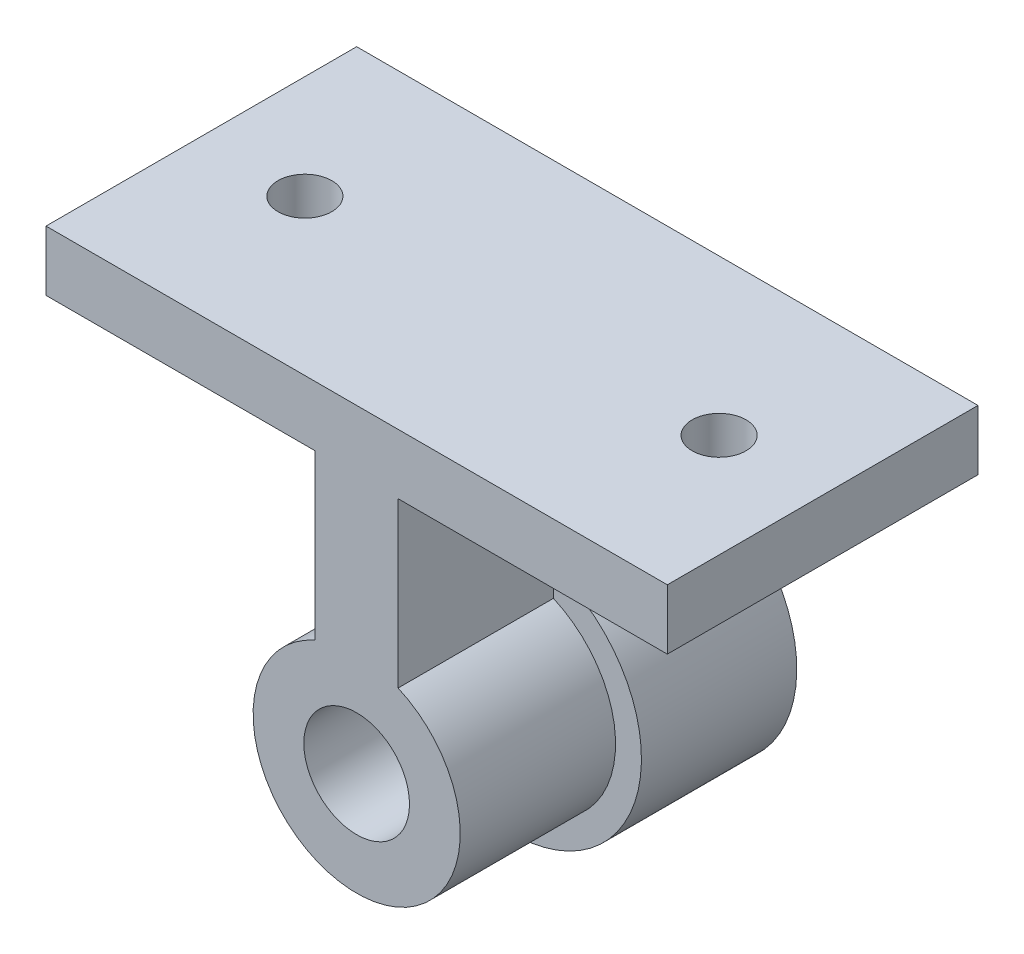
from build123d import *

# Parameters (mm, degrees)
SKETCH1_W           = 60
SKETCH1_H           = 30
BOSS_EXTRUDE1_DEPTH = 5.8
SKETCH2_R           = 2.6
CUT_EXTRUDE1_DEPTH  = 6
SKETCH3_R           = 5.1
BOSS_EXTRUDE2_DEPTH = 15
BOSS_EXTRUDE3_START = -15
SKETCH4_R           = 5.1
BOSS_EXTRUDE3_DEPTH = 15
SKETCH5_R           = 10.75
CUT_EXTRUDE2_DEPTH  = 11


with BuildPart() as part:
    # Sketch1 → Boss-Extrude1 (new body)
    with BuildSketch(Plane(origin=(0, 0, 0), x_dir=(1, 0, 0), z_dir=(0, 1, 0))):
        Rectangle(SKETCH1_W, SKETCH1_H)
    extrude(amount=BOSS_EXTRUDE1_DEPTH)

    # Sketch2 → Cut-Extrude1 (cut)
    with BuildSketch(Plane(origin=(0, 0, 0), x_dir=(1, 0, 0), z_dir=(0, 1, 0))):
        with Locations(Location((-20, 0, 0), (0, 0, 270))):
            Circle(SKETCH2_R)
    cut_extrude1 = extrude(amount=CUT_EXTRUDE1_DEPTH, mode=Mode.SUBTRACT)

    # Mirror1: Cut-Extrude1 across plane
    add(cut_extrude1.mirror(Plane(origin=(0, 0, 0), x_dir=(0, 0, 1), z_dir=(1, 0, 0))), mode=Mode.SUBTRACT)

    # Sketch3 → Boss-Extrude2 (add)
    with BuildSketch(Plane.XY):
        with BuildLine():
            Line((-4, 0), (4, 0))
            Line((4, 0), (4, -15.83484861))
            ThreePointArc((4, -15.83484861), (0, -35), (-4, -15.83484861))
            Line((-4, -15.83484861), (-4, 0))
        make_face()
        with Locations((0, -25)):
            Circle(SKETCH3_R, mode=Mode.SUBTRACT)
    extrude(amount=BOSS_EXTRUDE2_DEPTH)

    # Sketch4 → Boss-Extrude3 (add)
    with BuildSketch(Plane.XY.offset(BOSS_EXTRUDE3_START)):
        with BuildLine():
            Line((-6, -14.0341439), (-6, 0))
            Line((-6, 0), (6, 0))
            Line((6, 0), (6, -14.0341439))
            ThreePointArc((6, -14.0341439), (0, -37.5), (-6, -14.0341439))
        make_face()
        with Locations((0, -25)):
            Circle(SKETCH4_R, mode=Mode.SUBTRACT)
    extrude(amount=BOSS_EXTRUDE3_DEPTH)

    # Sketch5 → Cut-Extrude2 (cut)
    with BuildSketch(Plane(origin=(0, 0, -15), x_dir=(-1, 0, 0), z_dir=(0, 0, -1))):
        with Locations((0, -25)):
            Circle(SKETCH5_R)
    extrude(amount=-CUT_EXTRUDE2_DEPTH, mode=Mode.SUBTRACT)


solid = part.part
